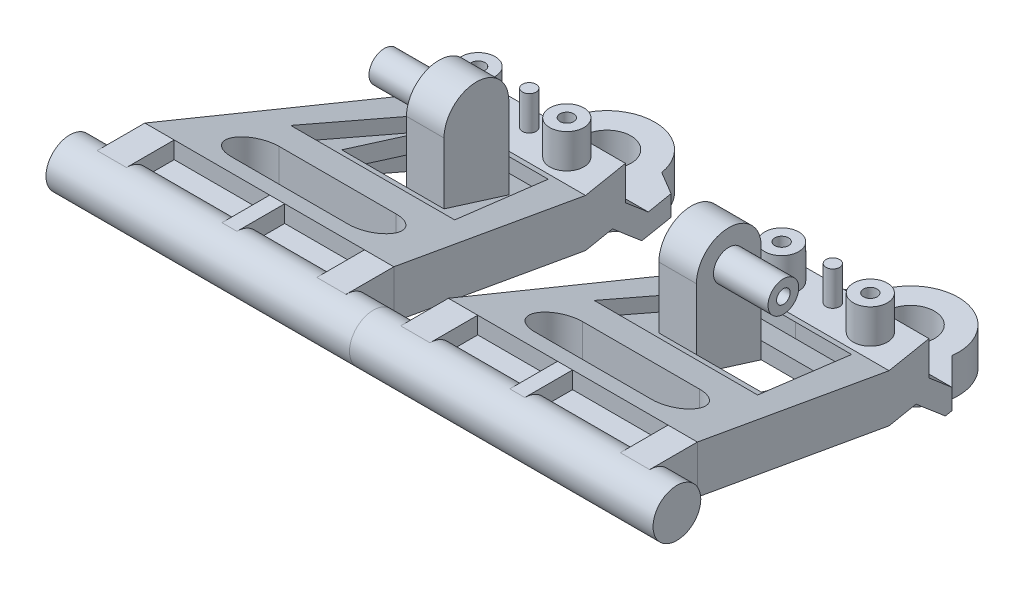
from build123d import *

# Parameters (mm, degrees)
BOSS_EXTRUDE1_DEPTH             = 36.5
CUT_EXTRUDE1_DEPTH              = 76.543034093
CUT_EXTRUDE1_DEPTH_BACK         = 36.5
SKETCH2_R                       = 3.5
SKETCH2_W                       = 9.5
SKETCH2_H                       = 9.5
SKETCH5_W                       = 11.7
SKETCH5_H                       = 7
SKETCH5_W_2                     = 14
CUT_EXTRUDE2_DEPTH              = 2.5
SKETCH6_W                       = 14
SKETCH6_H                       = 7
SKETCH6_W_2                     = 11.7
CUT_EXTRUDE3_DEPTH              = 2.5
BOSS_EXTRUDE2_DEPTH             = 4
BOSS_EXTRUDE2_DEPTH_BACK        = 40.5
SKETCH3_R                       = 3.5
CUT_EXTRUDE4_REACH              = 79.555
CUT_EXTRUDE5_REACH              = 80.463
BOSS_EXTRUDE3_DEPTH             = 5.5
SKETCH10_R                      = 2.25
SKETCH10_R_2                    = 1
BOSS_EXTRUDE4_DEPTH             = 8
SKETCH11_R                      = 2.5
SKETCH11_R_2                    = 1
BOSS_EXTRUDE5_DEPTH             = 5
CUT_EXTRUDE7_DEPTH              = 12
CUT_EXTRUDE8_START              = 14.5
CUT_EXTRUDE8_DEPTH              = 8.25
CUT_EXTRUDE9_START              = 25.25
CUT_EXTRUDE9_DEPTH              = 8
SKETCH14_R                      = 7
SKETCH14_R_2                    = 3.5
BOSS_EXTRUDE6_DEPTH             = 2.5
BOSS_EXTRUDE6_DIRECTION_2_REACH = 82.238


with BuildPart() as part:
    # Sketch1 → Boss-Extrude1 (new body)
    with BuildSketch(Plane(origin=(0, 0, 0), x_dir=(0, 0, -1), z_dir=(1, 0, 0))):
        with BuildLine():
            Line((7, -3.5), (40.607142857, -14))
            Line((40.607142857, -14), (45.75, -18.5))
            Line((45.75, -18.5), (49.75, -18.5))
            Line((49.75, -18.5), (63.5, -18.5))
            Line((63.5, -18.5), (63.5, -15.5))
            Line((63.5, -15.5), (51.607142857, -15.5))
            Line((51.607142857, -15.5), (47.607142857, -12))
            Line((47.607142857, -12), (47.607142857, -7))
            Line((47.607142857, -7), (40.607142857, -7))
            Line((40.607142857, -7), (7, 3.5))
            Line((7, 3.5), (0, 3.5))
            ThreePointArc((0, 3.5), (-3.5, 0), (0, -3.5))
            Line((0, -3.5), (7, -3.5))
        make_face()
    extrude(amount=BOSS_EXTRUDE1_DEPTH)

    # Sketch2 → Cut-Extrude1 (cut, two sides: drawn at the far end of the back side and taken through both)
    with BuildSketch(Plane(origin=(0, 0, 0), x_dir=(1, 0, 0), z_dir=(0, 1, 0)).offset(-CUT_EXTRUDE1_DEPTH_BACK)):
        with Locations(Location((18.25, 56.5, 0), (0, 0, 90))):
            Circle(SKETCH2_R)
        with BuildLine():
            Line((25.192824074, 55.607142857), (29.192824074, 51.607142857))
            Line((29.192824074, 51.607142857), (36.5, 7))
            Line((36.5, 7), (46.5, 7))
            Line((46.5, 7), (46.5, 73.5))
            Line((46.5, 73.5), (-10, 73.5))
            Line((-10, 73.5), (-10, 7))
            Line((-10, 7), (0, 7))
            Line((0, 7), (7.962423087, 55.607142857))
            Line((7.962423087, 55.607142857), (11.338109181, 57.607142857))
            ThreePointArc((11.338109181, 57.607142857), (19.250119601, 63.428185966), (25.192824074, 55.607142857))
        make_face()
        with BuildLine():
            Line((9.678067434, 17), (26.821932566, 17))
            ThreePointArc((26.821932566, 17), (30.321932566, 13.5), (26.821932566, 10))
            Line((26.821932566, 10), (9.678067434, 10))
            ThreePointArc((9.678067434, 10), (6.178067434, 13.5), (9.678067434, 17))
        make_face()
        with Locations((22, 30.857142857)):
            Rectangle(SKETCH2_W, SKETCH2_H)
    extrude(amount=CUT_EXTRUDE1_DEPTH + CUT_EXTRUDE1_DEPTH_BACK, mode=Mode.SUBTRACT)

    # Sketch5 → Cut-Extrude2 (cut)
    with BuildSketch(Plane(origin=(0, 3.5, 0), x_dir=(1, 0, 0), z_dir=(0, 1, 0))):
        with Locations((10.15, 3.5)):
            Rectangle(SKETCH5_W, SKETCH5_H)
        with Locations((25.2, 3.5)):
            Rectangle(SKETCH5_W_2, SKETCH5_H)
    extrude(amount=-CUT_EXTRUDE2_DEPTH, mode=Mode.SUBTRACT)

    # Sketch6 → Cut-Extrude3 (cut)
    with BuildSketch(Plane.XZ.offset(3.5)):
        with Locations((25.2, -3.5)):
            Rectangle(SKETCH6_W, SKETCH6_H)
        with Locations((10.15, -3.5)):
            Rectangle(SKETCH6_W_2, SKETCH6_H)
    extrude(amount=-CUT_EXTRUDE3_DEPTH, mode=Mode.SUBTRACT)

    # Sketch3 → Boss-Extrude2 (add, two sides: drawn at the far end of the back side and taken through both)
    with BuildSketch(Plane(origin=(36.5, 0, 0), x_dir=(0, 0, -1), z_dir=(1, 0, 0)).offset(-BOSS_EXTRUDE2_DEPTH_BACK)):
        Circle(SKETCH3_R)
    extrude(amount=BOSS_EXTRUDE2_DEPTH + BOSS_EXTRUDE2_DEPTH_BACK)

    # Cut-Extrude4: up to this plane
    cut_extrude4_end = Plane(origin=(36.5, 0.954324111, -8.391680434), z_dir=(0, 0.9544980251192885, -0.2982172363284494))
    # Sketch7 → Cut-Extrude4 (cut, up to the surface)
    with BuildSketch(Plane(origin=(0, 0, 0), x_dir=(1, 0, 0), z_dir=(0, 1, 0)), mode=Mode.PRIVATE) as cut_extrude4_sk1:
        Polygon((18.222476089, 22.107142857), (30.222476089, 22.107142857), (26.498512221, 39.607142857), (18.248512221, 39.607142857), (9.998548743, 39.631691156), (6.222529213, 22.142849473), align=None)
    cut_extrude4_tool1 = split(extrude(cut_extrude4_sk1.sketch, amount=-CUT_EXTRUDE4_REACH, mode=Mode.PRIVATE), bisect_by=cut_extrude4_end, keep=Keep.BOTH, mode=Mode.PRIVATE)
    add(cut_extrude4_tool1.solids().sort_by_distance((18.234702, 0, -30.324637))[0], mode=Mode.SUBTRACT)

    # Cut-Extrude5: up to this plane
    cut_extrude5_end = Plane(origin=(36.5, -1.272837948, -7.695840216), z_dir=(0, 0.9544980251192885, -0.2982172363284494))
    # Sketch8 → Cut-Extrude5 (cut, up to the surface)
    with BuildSketch(Plane(origin=(0, -18.5, 0), x_dir=(1, 0, 0), z_dir=(0, 1, 0)), mode=Mode.PRIVATE) as cut_extrude5_sk1:
        Polygon((18.222476089, 22.107142857), (30.222476089, 22.107142857), (26.498512221, 39.607142857), (18.248512221, 39.607142857), (9.998548743, 39.631691156), (6.222529213, 22.142849473), align=None)
    cut_extrude5_tool1 = split(extrude(cut_extrude5_sk1.sketch, amount=CUT_EXTRUDE5_REACH, mode=Mode.PRIVATE), bisect_by=cut_extrude5_end, keep=Keep.BOTH, mode=Mode.PRIVATE)
    add(cut_extrude5_tool1.solids().sort_by_distance((18.234702, -18.5, -30.324637))[0], mode=Mode.SUBTRACT)

    # Sketch9 → Boss-Extrude3 (add)
    with BuildSketch(Plane(origin=(17.25, 0, 0), x_dir=(0, 0, -1), z_dir=(1, 0, 0))):
        with BuildLine():
            Line((26.107142857, -4.580581258), (26.107142857, 4.419418742))
            ThreePointArc((26.107142857, 4.419418742), (30.857142857, 9.169418742), (35.607142857, 4.419418742))
            Line((35.607142857, 4.419418742), (35.607142857, -7.548700281))
            Line((35.607142857, -7.548700281), (26.107142857, -4.580581258))
        make_face()
    extrude(amount=-BOSS_EXTRUDE3_DEPTH)

    # Sketch10 → Boss-Extrude4 (add)
    with BuildSketch(Plane(origin=(17.25, 0, 0), x_dir=(0, 0, -1), z_dir=(1, 0, 0))):
        with Locations((30.857142857, 4.419418742)):
            Circle(SKETCH10_R)
        with Locations((30.857142857, 4.419418742)):
            Circle(SKETCH10_R_2, mode=Mode.SUBTRACT)
    extrude(amount=BOSS_EXTRUDE4_DEPTH)

    # Sketch11 → Boss-Extrude5 (add)
    # profile 1 of 3: a face of its own
    with BuildSketch(Plane(origin=(0, -7, 0), x_dir=(1, 0, 0), z_dir=(0, 1, 0))):
        with Locations(Location((11.75, 44.107142857, 0), (0, 0, 90))):
            Circle(SKETCH11_R)
        with Locations(Location((11.75, 44.107142857, 0), (0, 0, 270))):
            Circle(SKETCH11_R_2, mode=Mode.SUBTRACT)
    # profile 2 of 3: a face of its own
    with BuildSketch(Plane(origin=(0, -7, 0), x_dir=(1, 0, 0), z_dir=(0, 1, 0))):
        with Locations(Location((18.25, 45.107142857, 0), (0, 0, 90))):
            Circle(SKETCH11_R_2)
    # profile 3 of 3: a face of its own
    with BuildSketch(Plane(origin=(0, -7, 0), x_dir=(1, 0, 0), z_dir=(0, 1, 0))):
        with Locations(Location((24.75, 44.107142857, 0), (0, 0, 90))):
            Circle(SKETCH11_R)
        with Locations(Location((24.75, 44.107142857, 0), (0, 0, 90))):
            Circle(SKETCH11_R_2, mode=Mode.SUBTRACT)
    extrude(amount=BOSS_EXTRUDE5_DEPTH)

    # Sketch13 → Cut-Extrude7 (cut)
    with BuildSketch(Plane(origin=(0, 0, 0), x_dir=(0, 0, -1), z_dir=(1, 0, 0))):
        Polygon((53.908508937, -21.5), (45.337080366, -14), (40.607142857, -14), (40.607142857, -21.5), align=None)
    extrude(amount=CUT_EXTRUDE7_DEPTH, mode=Mode.SUBTRACT)

    # Sketch13<3> → Cut-Extrude8 (cut)
    with BuildSketch(Plane(origin=(0, 0, 0), x_dir=(0, 0, -1), z_dir=(1, 0, 0)).offset(CUT_EXTRUDE8_START)):
        Polygon((53.908508937, -21.5), (45.337080366, -14), (40.607142857, -14), (40.607142857, -21.5), align=None)
    extrude(amount=CUT_EXTRUDE8_DEPTH, mode=Mode.SUBTRACT)

    # Sketch13<4> → Cut-Extrude9 (cut)
    with BuildSketch(Plane(origin=(0, 0, 0), x_dir=(0, 0, -1), z_dir=(1, 0, 0)).offset(CUT_EXTRUDE9_START)):
        Polygon((53.908508937, -21.5), (45.337080366, -14), (40.607142857, -14), (40.607142857, -21.5), align=None)
    extrude(amount=CUT_EXTRUDE9_DEPTH, mode=Mode.SUBTRACT)

    # Sketch14 → Boss-Extrude6 (add)
    with BuildSketch(Plane.XZ.offset(18.5)):
        with Locations(Location((18.25, -56.5, 0), (0, 0, 270))):
            Circle(SKETCH14_R)
        with Locations(Location((18.25, -56.5, 0), (0, 0, 270))):
            Circle(SKETCH14_R_2, mode=Mode.SUBTRACT)
    extrude(amount=BOSS_EXTRUDE6_DEPTH)

    # Boss-Extrude6 direction 2: up to this face of the body (flat: up to its plane)
    boss_extrude6_direction_2_end = Plane(part.part.faces().sort_by_distance((27.530853261, -16.180546647, -47.829133677))[0])
    # Sketch14 → Boss-Extrude6 direction 2 (add, up to the picked face)
    with BuildSketch(Plane.XZ.offset(18.5), mode=Mode.PRIVATE) as boss_extrude6_direction_2_sk1:
        with Locations(Location((18.25, -56.5, 0), (0, 0, 270))):
            Circle(SKETCH14_R)
        with Locations(Location((18.25, -56.5, 0), (0, 0, 270))):
            Circle(SKETCH14_R_2, mode=Mode.SUBTRACT)
    boss_extrude6_direction_2_tool1 = split(extrude(boss_extrude6_direction_2_sk1.sketch, amount=-BOSS_EXTRUDE6_DIRECTION_2_REACH, mode=Mode.PRIVATE), bisect_by=boss_extrude6_direction_2_end, keep=Keep.BOTH, mode=Mode.PRIVATE)
    add(boss_extrude6_direction_2_tool1.solids().sort_by(Axis((18.25, -18.5, -49.69799), (0, 1, 0)))[0])


with BuildPart() as body_2:
    # Mirror2: mirrored copy
    add(part.part.mirror(Plane(origin=(-4, 0, 0), x_dir=(0, 0, 1), z_dir=(1, 0, 0))))


solid = Compound([part.part, body_2.part])
